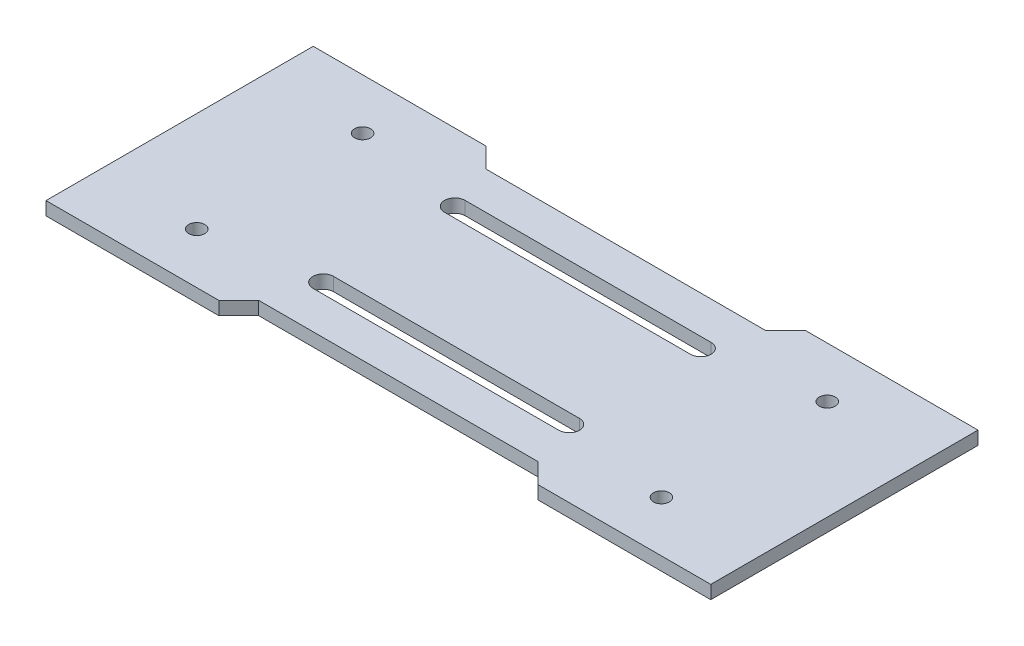
from build123d import *

# Parameters (mm, degrees)
BOSS_EXTRUDE1_DEPTH     = 1
CUT_EXTRUDE1_DEPTH      = 54.925967771
CUT_EXTRUDE1_DEPTH_BACK = 54.925967771
SKETCH2_R               = 1.2


with BuildPart() as part:
    # Sketch1 → Boss-Extrude1 (new, symmetric)
    with BuildSketch(Plane(origin=(0, 0, 0), x_dir=(1, 0, 0), z_dir=(0, 1, 0))):
        Polygon((-50, 20.1), (-50, -20.1), (-24, -20.1), (-21, -17.1), (21, -17.1), (24, -20.1), (50, -20.1), (50, 20.1), (24, 20.1), (21, 17.1), (-21, 17.1), (-24, 20.1), align=None)
    extrude(amount=BOSS_EXTRUDE1_DEPTH, both=True)

    # Sketch2 → Cut-Extrude1 (cut, two sides: drawn at the far end of the back side and taken through both)
    with BuildSketch(Plane(origin=(0, 1, 0), x_dir=(1, 0, 0), z_dir=(0, 1, 0)).offset(-CUT_EXTRUDE1_DEPTH_BACK)):
        with Locations(Location((-34.95, 12.475, 0), (0, 0, 270))):
            Circle(SKETCH2_R)
        with Locations(Location((-34.95, -12.475, 0), (0, 0, 270))):
            Circle(SKETCH2_R)
        with Locations(Location((34.95, -12.475, 0), (0, 0, 270))):
            Circle(SKETCH2_R)
        with Locations(Location((34.95, 12.475, 0), (0, 0, 270))):
            Circle(SKETCH2_R)
        with BuildLine():
            Line((-18.5, 11.45), (18.5, 11.45))
            ThreePointArc((18.5, 11.45), (20.05, 9.9), (18.5, 8.35))
            Line((18.5, 8.35), (-18.5, 8.35))
            ThreePointArc((-18.5, 8.35), (-20.05, 9.9), (-18.5, 11.45))
        make_face()
        with BuildLine():
            Line((-18.5, -8.35), (18.5, -8.35))
            ThreePointArc((18.5, -8.35), (20.05, -9.9), (18.5, -11.45))
            Line((18.5, -11.45), (-18.5, -11.45))
            ThreePointArc((-18.5, -11.45), (-20.05, -9.9), (-18.5, -8.35))
        make_face()
    extrude(amount=CUT_EXTRUDE1_DEPTH + CUT_EXTRUDE1_DEPTH_BACK, mode=Mode.SUBTRACT)


solid = part.part
